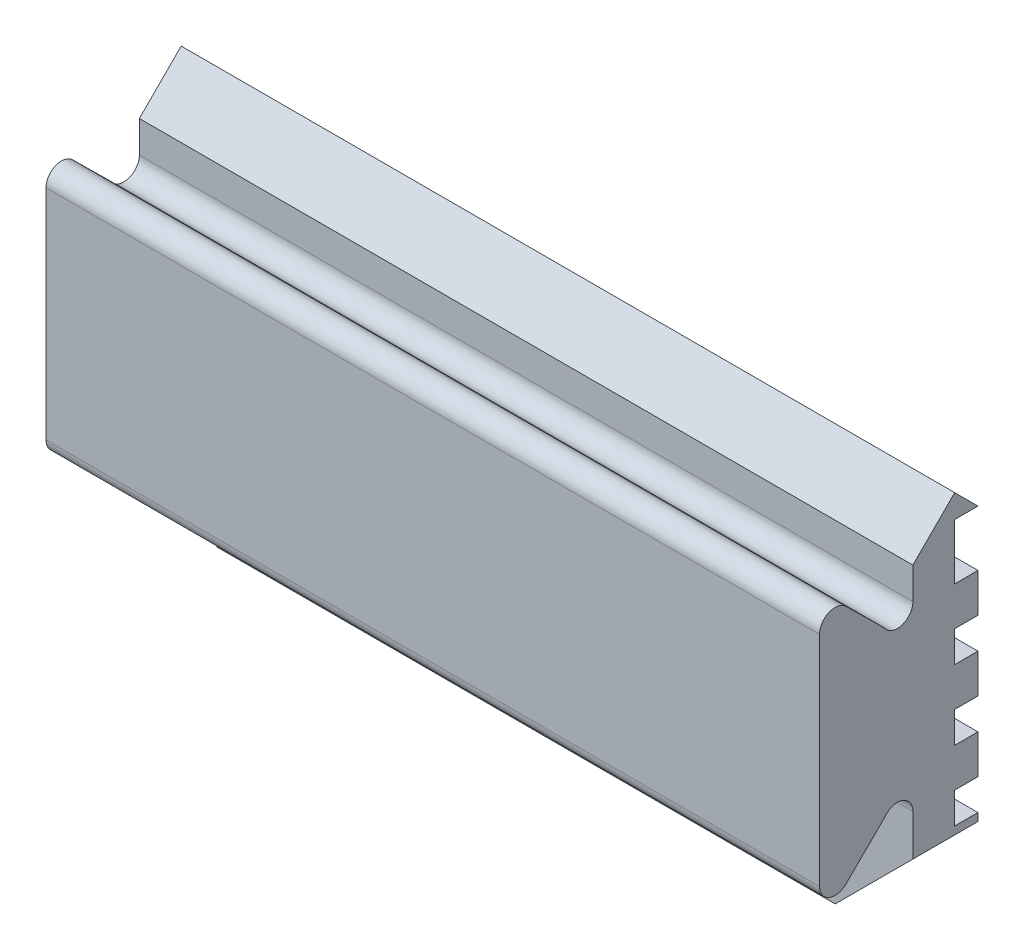
from build123d import *

# Parameters (mm, degrees)
EXTRUDE_1_DEPTH     = 49.8
CHAMFER_1_SIZE      = 5
CUT_EXTRUDE_1_DEPTH = 49.8
CUT_EXTRUDE_2_DEPTH = 1.5
CUT_EXTRUDE_5_DEPTH = 1.5
CUT_EXTRUDE_6_DEPTH = 1.5
FILLET_1_R          = 0.3


with BuildPart() as part:
    # 草图1 → 凸台-拉伸1 (new body)
    with BuildSketch(Plane(origin=(0, 0, 0), x_dir=(0, 0, -1), z_dir=(1, 0, 0))):
        with BuildLine():
            Line((-3.3011643203984544, 4.869061466212711), (-14.311631849697747, 4.869061466212711))
            Line((-14.311631849697747, 4.869061466212711), (-14.311631849697747, -2.159184752168928))
            ThreePointArc((-14.311631849697747, -2.1591847521689282), (-13.694314644696359, -3.083064362059199), (-12.60452430575002, -2.8662900962872895))
            Line((-12.60452430575002, -2.8662900962872895), (-10.135977537233877, -0.4266270598954794))
            ThreePointArc((-10.135977537233877, -0.42662705989547856), (-10.004086660367205, -0.2658876156487018), (-9.841806105066398, -0.1358976402325789))
            ThreePointArc((-9.841806105066398, -0.1358976402325789), (-8.821917682779581, -0.09946220767270797), (-8.301164320376756, -0.9771386117116159))
            Line((-8.301164320376756, -0.9771386117116161), (-8.301164320376754, -3.01590252304511))
            Line((-8.301164320376754, -3.01590252304511), (-8.301164320376756, -8.640917781834164))
            Line((-8.301164320376756, -8.640917781834164), (-3.3011643203767598, -8.640917781834164))
            Line((-3.30116432037676, -8.640917781834164), (-3.30116432037676, 4.869061466212711))
        make_face()
        with BuildLine():
            ThreePointArc((-8.301164320376754, 10.71526154413704), (-8.821917682779581, 9.837585140098131), (-9.841806105066398, 9.874020572658003))
            ThreePointArc((-9.841806105066398, 9.874020572658003), (-10.004086660367204, 10.004010548074126), (-10.135977537233877, 10.164749992320901))
            Line((-10.135977537233877, 10.164749992320901), (-12.60452430575002, 12.604413028712713))
            ThreePointArc((-12.60452430575002, 12.604413028712713), (-13.694314644696359, 12.821187294484622), (-14.311631849697747, 11.89730768459435))
            Line((-14.311631849697747, 11.89730768459435), (-14.311631849697747, 4.869061466212711))
            Line((-14.311631849697747, 4.869061466212711), (-3.3011643203984544, 4.869061466212711))
            Line((-3.30116432037676, 4.869061466212711), (-3.30116432037676, 13.139889713283024))
            Line((-3.30116432037676, 13.139889713283026), (-5.608236006167775, 15.446957584376776))
            Line((-5.608236006167775, 15.446957584376776), (-8.301164320376754, 12.754025455470533))
            Line((-8.301164320376754, 12.754025455470533), (-8.301164320376756, 10.71526154413704))
        make_face()
    extrude(amount=EXTRUDE_1_DEPTH)

    # 倒角1
    chamfer_1_edges = [part.edges().sort_by_distance(p)[0] for p in [
        (0, -8.640917781834164, 5.801164320376758),
        (49.8, -8.640917781834164, 5.801164320376758),
    ]]
    chamfer(chamfer_1_edges, length=CHAMFER_1_SIZE)

    # 草图3 → 切除-拉伸1 (cut)
    with BuildSketch(Plane(origin=(49.8, 0, 0), x_dir=(0, 0, -1), z_dir=(1, 0, 0))):
        Polygon((-4.108236006167775, 13.94696006459702), (-3.301164320376763, 13.94696006459702), (-3.30116432037676, -8.640917781834164), (-4.108236006167774, -8.640917781834164), align=None)
    extrude(amount=-CUT_EXTRUDE_1_DEPTH, mode=Mode.SUBTRACT)

    # 草图4 → 切除-拉伸2 (cut)
    with BuildSketch(Plane(origin=(0, -4.7e-16, 4.1082360061677745), x_dir=(-1, 0, 0), z_dir=(0, 1.2e-16, -1))):
        Polygon((-49.8, -5.640917781834157), (0, -5.640917781834158), (0, -7.640917781834159), (-49.8, -7.640917781834159), align=None)
        Polygon((-49.80000000000001, -1.1409177818341574), (-1.544e-14, -1.140917781834159), (-1.544e-14, -3.140917781834159), (-49.80000000000001, -3.140917781834159), align=None)
        Polygon((-49.800000000000026, 3.359082218165842), (-3.087e-14, 3.359082218165841), (-3.087e-14, 1.3590822181658406), (-49.800000000000026, 1.3590822181658406), align=None)
        Polygon((-49.80000000000005, 7.859082218165841), (-4.631e-14, 7.859082218165839), (-4.631e-14, 5.859082218165839), (-49.80000000000005, 5.859082218165839), align=None)
        Polygon((-49.80000000000006, 12.359082218165842), (-6.174e-14, 12.35908221816584), (-6.174e-14, 10.35908221816584), (-49.80000000000006, 10.35908221816584), align=None)
    extrude(amount=-CUT_EXTRUDE_2_DEPTH, mode=Mode.SUBTRACT)

    # 草图5 → 切除-拉伸5 (cut)
    with BuildSketch(Plane(origin=(0, 0, 5.608236006167775), x_dir=(-1, 0, 0), z_dir=(0, 0, -1))):
        Polygon((0, 13.94696006459702), (-46.31009994685559, -7.1308178349785605), (-44.799999999999976, -8.640917781834164), (-6.175e-14, 11.749546738532302), align=None)
        Polygon((-49.79999999999993, 11.74954673853228), (-49.8, 13.946960064596997), (-3.489900053144389, -7.13081783497854), (-4.999999999999997, -8.640917781834142), align=None)
    extrude(amount=CUT_EXTRUDE_5_DEPTH, mode=Mode.SUBTRACT)

    # 草图6 → 切除-拉伸6 (cut)
    with BuildSketch(Plane(origin=(0, -4.7e-16, 4.1082360061677745), x_dir=(-1, 0, 0), z_dir=(0, 1.2e-16, -1))):
        Polygon((-28.321709391936835, -1.1409177818341594), (-21.478290608063137, -1.1409177818341603), (-24.89999999999999, 0.41645373502506017), align=None)
        Polygon((-17.76992020746784, 5.85908221816584), (-32.03007979253217, 5.859082218165842), (-26.53731625651111, 3.3590822181658413), (-23.26268374348888, 3.3590822181658413), align=None)
    extrude(amount=-CUT_EXTRUDE_6_DEPTH, mode=Mode.SUBTRACT)

    # 圆角1
    fillet_1_edges = [part.edges().sort_by_distance(p)[0] for p in [
        (41.252239337738956, 7.85908221816584, 4.858236006167775),
        (31.36526497290105, 3.3590822181658417, 4.858236006167775),
        (41.91705415737007, 10.359082218165842, 4.858236006167775),
        (8.547760662261016, 7.85908221816585, 4.858236006167775),
        (7.8829458426299635, 10.359082218165838, 4.858236006167775),
        (22.143105427694266, 1.3590822181658417, 4.858236006167775),
        (12.25613106285637, -3.1409177818341556, 4.858236006167775),
        (11.591316243225233, -5.640917781834158, 4.8582360061677745),
        (27.656894572305735, 1.3590822181658355, 4.858236006167775),
        (37.543868937143614, -3.1409177818341654, 4.858236006167775),
        (38.208683756774704, -5.6409177818341565, 4.8582360061677745),
        (18.434735027098903, 3.3590822181658484, 4.858236006167775),
    ]]
    fillet(fillet_1_edges, radius=FILLET_1_R)


solid = part.part
